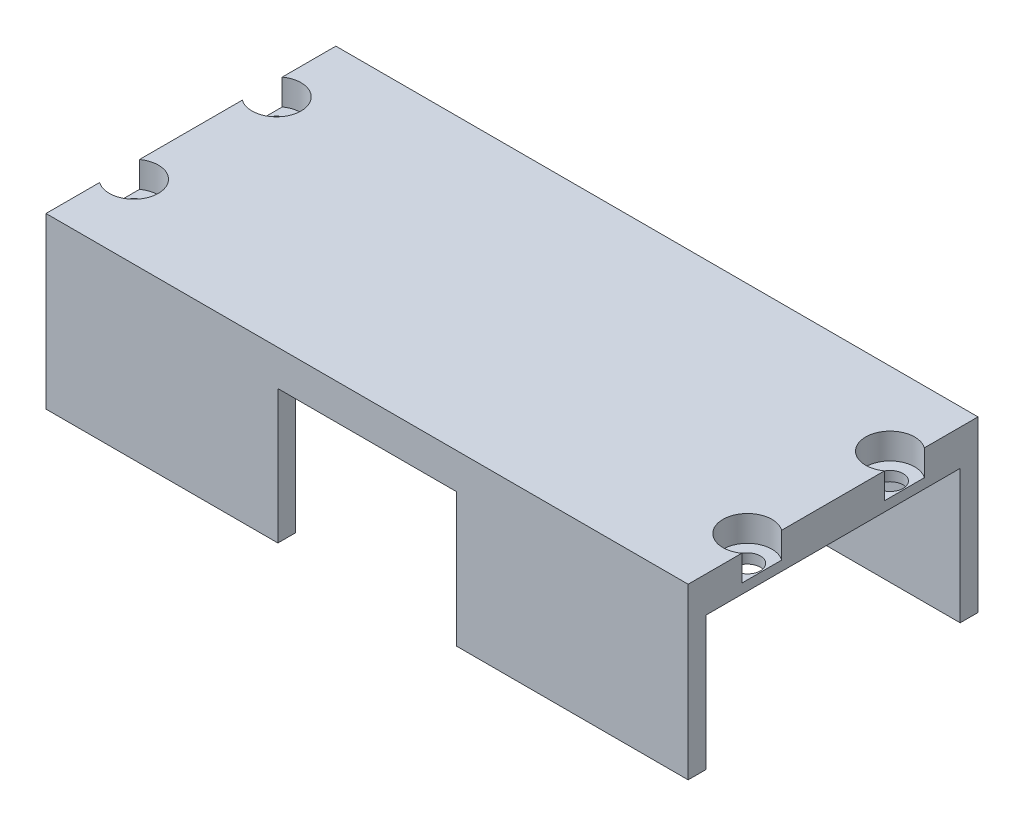
from build123d import *

# Parameters (mm, degrees)
SKETCH1_W                                            = 72
SKETCH1_H                                            = 32.5
BOSS_EXTRUDE1_DEPTH                                  = 4
CBORE_FOR_M2_5_HEX_SOCKET_HEAD_CAP_SCREW_D           = 2.9
CBORE_FOR_M2_5_HEX_SOCKET_HEAD_CAP_SCREW_CBORE_D     = 5.5
CBORE_FOR_M2_5_HEX_SOCKET_HEAD_CAP_SCREW_CBORE_DEPTH = 2.9
SKETCH5_W                                            = 26
SKETCH5_H                                            = 2
BOSS_EXTRUDE2_DEPTH                                  = 15


with BuildPart() as part:
    # Sketch1 → Boss-Extrude1 (new body)
    with BuildSketch(Plane(origin=(0, 0, 0), x_dir=(1, 0, 0), z_dir=(0, 1, 0))):
        with Locations((36, 16.25)):
            Rectangle(SKETCH1_W, SKETCH1_H)
    extrude(amount=BOSS_EXTRUDE1_DEPTH)

    # CBORE for M2.5 Hex Socket Head Cap Screw1 (through all)
    with Locations(Plane(origin=(0, 4, 0), x_dir=(1, 0, 0), z_dir=(0, 1, 0))):
        with Locations((-10.4, 24.25), (1.6, 24.25), (1.6, 8.25), (-10.4, 8.25), (82.4, 8.25), (70.4, 8.25), (70.4, 24.25), (82.4, 24.25)):
            CounterBoreHole(CBORE_FOR_M2_5_HEX_SOCKET_HEAD_CAP_SCREW_D / 2, CBORE_FOR_M2_5_HEX_SOCKET_HEAD_CAP_SCREW_CBORE_D / 2, CBORE_FOR_M2_5_HEX_SOCKET_HEAD_CAP_SCREW_CBORE_DEPTH)

    # Sketch5 → Boss-Extrude2 (add)
    with BuildSketch(Plane.XZ):
        with Locations((13, -1)):
            Rectangle(SKETCH5_W, SKETCH5_H)
        with Locations((13, -31.5)):
            Rectangle(SKETCH5_W, SKETCH5_H)
        with Locations((59, -1)):
            Rectangle(SKETCH5_W, SKETCH5_H)
        with Locations((59, -31.5)):
            Rectangle(SKETCH5_W, SKETCH5_H)
    extrude(amount=BOSS_EXTRUDE2_DEPTH)


solid = part.part
